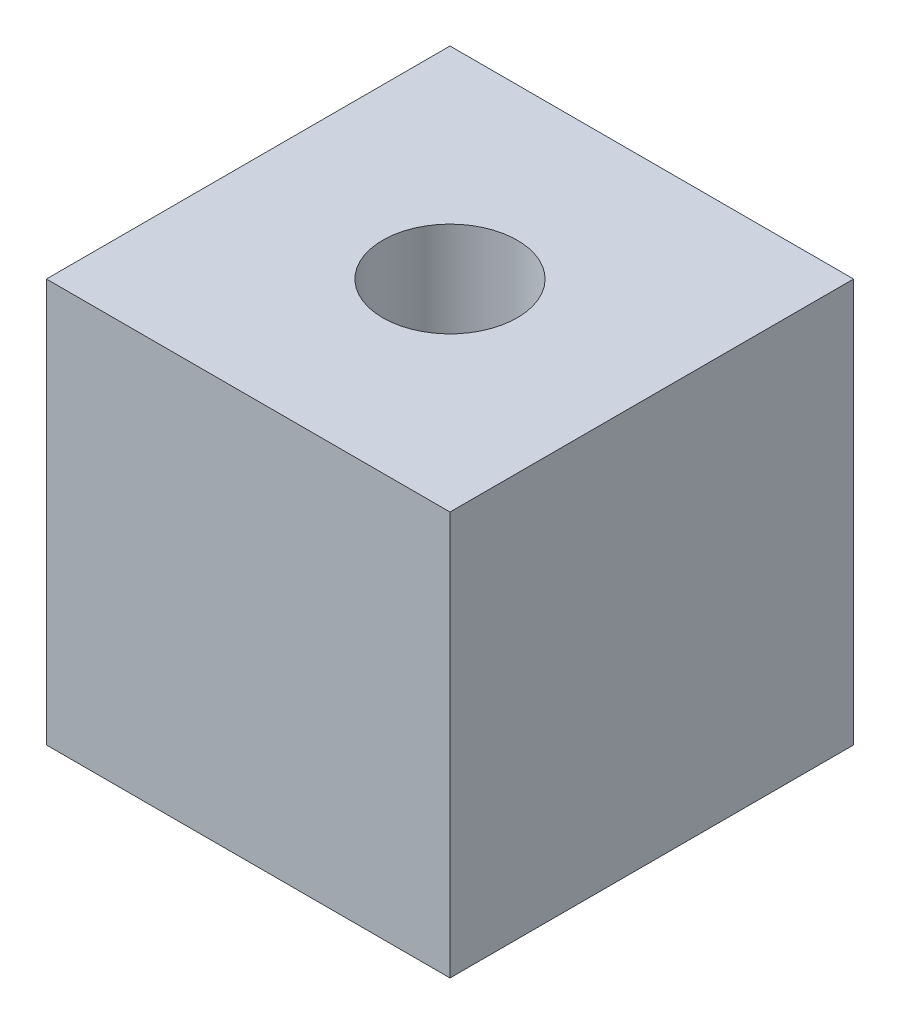
from build123d import *

# Parameters (mm, degrees)
SKETCH1_W           = 12
SKETCH1_H           = 12
SKETCH1_R           = 2
BOSS_EXTRUDE1_DEPTH = 12


with BuildPart() as part:
    # Sketch1 → Boss-Extrude1 (new body)
    with BuildSketch(Plane(origin=(0, 0, 0), x_dir=(1, 0, 0), z_dir=(0, 1, 0))):
        with Locations((6, -6)):
            Rectangle(SKETCH1_W, SKETCH1_H)
        with Locations(Location((6, -6, 0), (0, 0, 270))):
            Circle(SKETCH1_R, mode=Mode.SUBTRACT)
    extrude(amount=BOSS_EXTRUDE1_DEPTH)


solid = part.part
